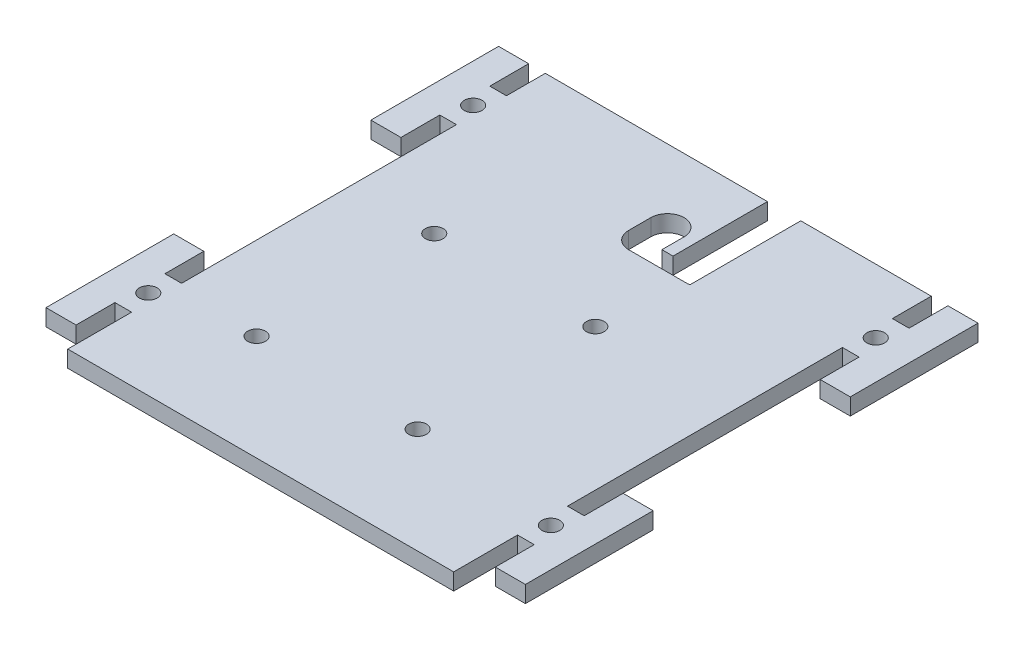
from build123d import *

# Parameters (mm, degrees)
SKETCH_1_R      = 1.6
EXTRUDE_1_DEPTH = 3


with BuildPart() as part:
    # 草图1 → 凸台-拉伸1 (new body)
    with BuildSketch(Plane(origin=(0, 0, 0), x_dir=(1, 0, 0), z_dir=(0, 1, 0))):
        with BuildLine():
            Line((-25.423831263, 10.512307079), (44.076168737, 10.512307079))
            Line((44.076168737, 10.512307079), (44.076168737, 22.012307079))
            Line((44.076168737, 22.012307079), (47.076168737, 22.012307079))
            Line((47.076168737, 22.012307079), (47.076168737, 15.012307079))
            Line((47.076168737, 15.012307079), (52.490895584, 15.012307079))
            Line((52.490895584, 15.012307079), (52.490895584, 38.012307079))
            Line((52.490895584, 38.012307079), (47.076168737, 38.012307079))
            Line((47.076168737, 38.012307079), (47.076168737, 31.012307079))
            Line((47.076168737, 31.012307079), (44.076168737, 31.012307079))
            Line((44.076168737, 31.012307079), (44.076168737, 80.512307079))
            Line((44.076168737, 80.512307079), (47.076168737, 80.512307079))
            Line((47.076168737, 80.512307079), (47.076168737, 73.512307079))
            Line((47.076168737, 73.512307079), (52.490895584, 73.512307079))
            Line((52.490895584, 73.512307079), (52.490895584, 96.512307079))
            Line((52.490895584, 96.512307079), (47.076168737, 96.512307079))
            Line((47.076168737, 96.512307079), (47.076168737, 89.512307079))
            Line((47.076168737, 89.512307079), (44.076168737, 89.512307079))
            Line((44.076168737, 89.512307079), (44.076168737, 96.512307079))
            Line((44.076168737, 96.512307079), (20.576168737, 96.512307079))
            Line((20.576168737, 96.512307079), (20.576168737, 76.566499541))
            ThreePointArc((20.576168737, 76.566499541), (20.284948115, 76.523300877), (19.990895584, 76.508854947))
            Line((19.990895584, 76.508854947), (9.576168737, 76.508854947))
            ThreePointArc((9.576168737, 76.508854947), (7.454848394, 77.387534604), (6.576168737, 79.508854947))
            Line((6.576168737, 79.508854947), (6.576168737, 83.508854947))
            ThreePointArc((6.576168737, 83.508854947), (9.576168737, 86.508854947), (12.576168737, 83.508854947))
            Line((12.576168737, 83.508854947), (12.576168737, 79.508854947))
            Line((12.576168737, 79.508854947), (14.576168737, 79.508854947))
            Line((14.576168737, 79.508854947), (14.576168737, 96.512307079))
            Line((14.576168737, 96.512307079), (-25.423831263, 96.512307079))
            Line((-25.423831263, 96.512307079), (-25.423831263, 89.512307079))
            Line((-25.423831263, 89.512307079), (-28.423831263, 89.512307079))
            Line((-28.423831263, 89.512307079), (-28.423831263, 96.512307079))
            Line((-28.423831263, 96.512307079), (-33.838558109, 96.512307079))
            Line((-33.838558109, 96.512307079), (-33.838558109, 73.512307079))
            Line((-33.838558109, 73.512307079), (-28.423831263, 73.512307079))
            Line((-28.423831263, 73.512307079), (-28.423831263, 80.512307079))
            Line((-28.423831263, 80.512307079), (-25.423831263, 80.512307079))
            Line((-25.423831263, 80.512307079), (-25.423831263, 31.012307079))
            Line((-25.423831263, 31.012307079), (-28.423831263, 31.012307079))
            Line((-28.423831263, 31.012307079), (-28.423831263, 38.012307079))
            Line((-28.423831263, 38.012307079), (-33.838558109, 38.012307079))
            Line((-33.838558109, 38.012307079), (-33.838558109, 15.012307079))
            Line((-33.838558109, 15.012307079), (-28.423831263, 15.012307079))
            Line((-28.423831263, 15.012307079), (-28.423831263, 22.012307079))
            Line((-28.423831263, 22.012307079), (-25.423831263, 22.012307079))
            Line((-25.423831263, 22.012307079), (-25.423831263, 10.512307079))
        make_face()
        with Locations(Location((-10.423831263, 29.512307079, 0), (0, 0, 270))):
            Circle(SKETCH_1_R, mode=Mode.SUBTRACT)
        with Locations(Location((18.576168737, 29.512307079, 0), (0, 0, 270))):
            Circle(SKETCH_1_R, mode=Mode.SUBTRACT)
        with Locations(Location((18.576168737, 61.512307079, 0), (0, 0, 270))):
            Circle(SKETCH_1_R, mode=Mode.SUBTRACT)
        with Locations(Location((-10.423831263, 61.512307079, 0), (0, 0, 270))):
            Circle(SKETCH_1_R, mode=Mode.SUBTRACT)
        with Locations(Location((-26.923831263, 26.512307079, 0), (0, 0, 270))):
            Circle(SKETCH_1_R, mode=Mode.SUBTRACT)
        with Locations(Location((45.576168737, 26.512307079, 0), (0, 0, 270))):
            Circle(SKETCH_1_R, mode=Mode.SUBTRACT)
        with Locations(Location((45.576168737, 85.012307079, 0), (0, 0, 270))):
            Circle(SKETCH_1_R, mode=Mode.SUBTRACT)
        with Locations(Location((-26.923831263, 85.012307079, 0), (0, 0, 270))):
            Circle(SKETCH_1_R, mode=Mode.SUBTRACT)
    extrude(amount=EXTRUDE_1_DEPTH)


solid = part.part
